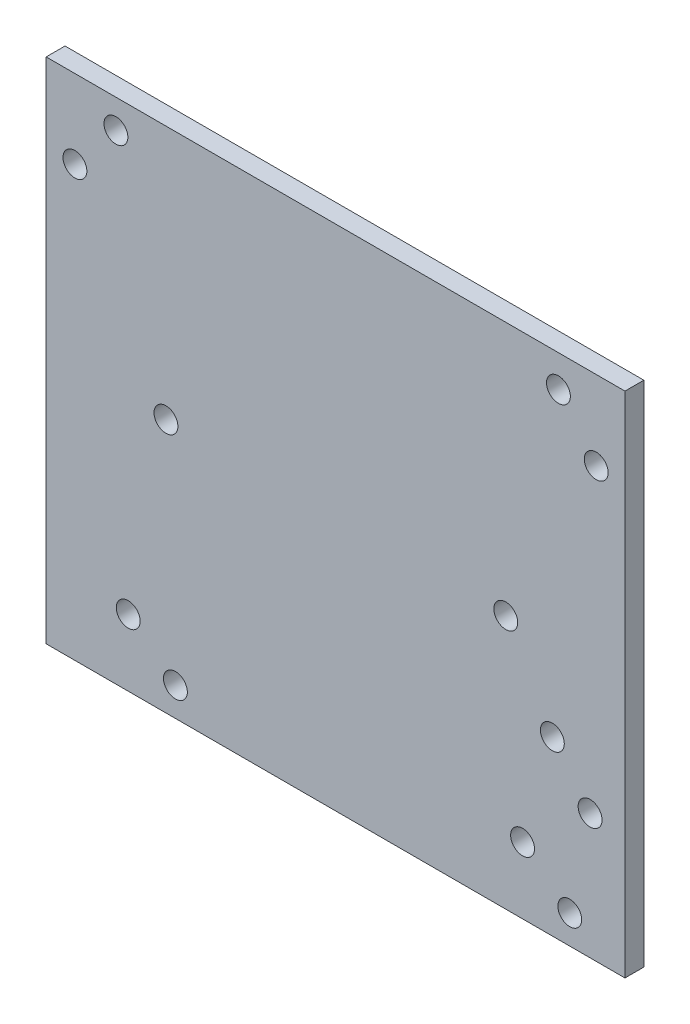
from build123d import *

# Parameters (mm, degrees)
SKETCH1_W           = 194.673052653
SKETCH1_H           = 170.954941939
SKETCH1_R           = 4.0127
SKETCH1_R_2         = 4.0254
BOSS_EXTRUDE1_DEPTH = 6.35


with BuildPart() as part:
    # Sketch1 → Boss-Extrude1 (new body)
    with BuildSketch(Plane.XY):
        with Locations((959.381316203, 302.755736555)):
            Rectangle(SKETCH1_W, SKETCH1_H)
        with Locations((1022.279959413, 239.653265586)):
            Circle(SKETCH1_R, mode=Mode.SUBTRACT)
        with Locations((1038.154959413, 226.953265586)):
            Circle(SKETCH1_R, mode=Mode.SUBTRACT)
        with Locations((889.644786871, 239.653265586)):
            Circle(SKETCH1_R, mode=Mode.SUBTRACT)
        with Locations((1034.333859926, 377.480941448)):
            Circle(SKETCH1_R, mode=Mode.SUBTRACT)
        with Locations((1047.042842529, 361.613131701)):
            Circle(SKETCH1_R, mode=Mode.SUBTRACT)
        with Locations((871.719789876, 361.793284425)):
            Circle(SKETCH1_R, mode=Mode.SUBTRACT)
        with Locations((885.505258454, 378.558207525)):
            Circle(SKETCH1_R, mode=Mode.SUBTRACT)
        with Locations((905.519786871, 226.953265586)):
            Circle(SKETCH1_R, mode=Mode.SUBTRACT)
        with Locations((902.338636269, 302.755736555)):
            Circle(SKETCH1_R, mode=Mode.SUBTRACT)
        with Locations(Location((1016.638636269, 302.755736555, 0), (0, 0, 180))):
            Circle(SKETCH1_R, mode=Mode.SUBTRACT)
        with Locations((1032.286575074, 275.289465586)):
            Circle(SKETCH1_R_2, mode=Mode.SUBTRACT)
        with Locations((1044.986575074, 259.414465586)):
            Circle(SKETCH1_R_2, mode=Mode.SUBTRACT)
    extrude(amount=BOSS_EXTRUDE1_DEPTH)


with BuildPart() as part_1:
    # Body-Move/Copy1: moved
    add(part.part.moved(Location((0, 0, -6.35))))


solid = part_1.part
